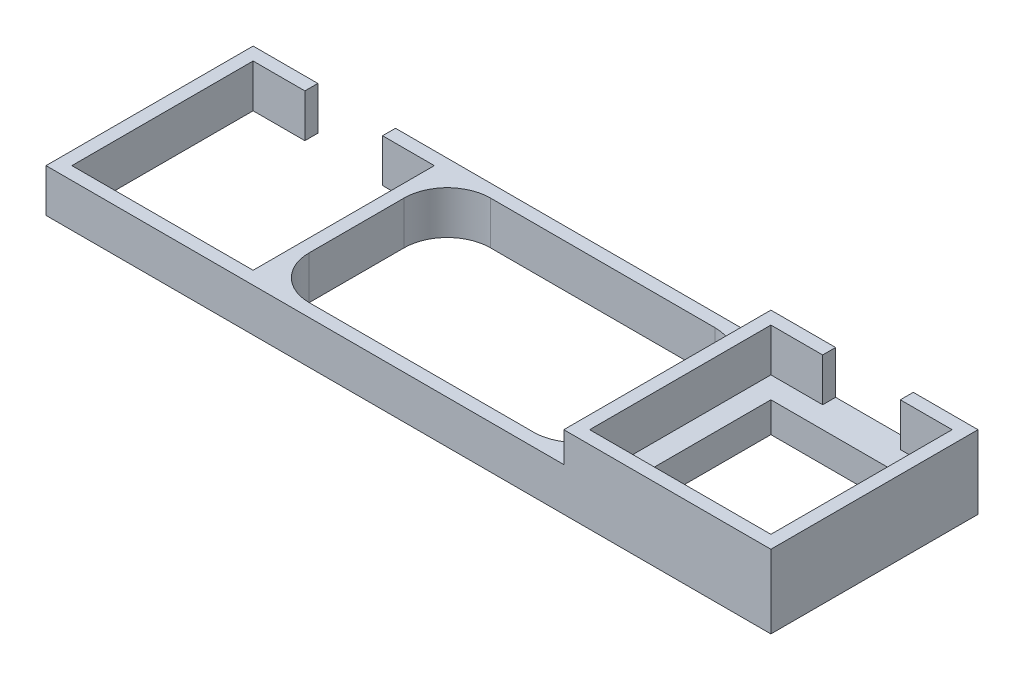
from build123d import *

# Parameters (mm, degrees)
SKETCH1_W           = 168
SKETCH1_H           = 48
SKETCH1_W_2         = 42
SKETCH1_H_2         = 42
SKETCH1_W_3         = 72
BOSS_EXTRUDE1_DEPTH = 10
SKETCH2_W           = 18
SKETCH2_H           = 10
CUT_EXTRUDE1_DEPTH  = 10
SKETCH3_W           = 42
SKETCH3_H           = 42
SKETCH3_W_2         = 32
SKETCH3_H_2         = 32
BOSS_EXTRUDE2_DEPTH = 7
BOSS_EXTRUDE3_DEPTH = 7
FILLET1_R           = 10
SKETCH6_W           = 18
SKETCH6_H           = 7
BOSS_EXTRUDE4_DEPTH = 3


with BuildPart() as part:
    # Sketch1 → Boss-Extrude1 (new body)
    with BuildSketch(Plane(origin=(0, 0, 0), x_dir=(1, 0, 0), z_dir=(0, 1, 0))):
        with Locations((-81, 21)):
            Rectangle(SKETCH1_W, SKETCH1_H)
        with Locations((-141, 21)):
            Rectangle(SKETCH1_W_2, SKETCH1_H_2, mode=Mode.SUBTRACT)
        with Locations((-21, 21)):
            Rectangle(SKETCH1_W_2, SKETCH1_H_2, mode=Mode.SUBTRACT)
        with Locations((-81, 21)):
            Rectangle(SKETCH1_W_3, SKETCH1_H_2, mode=Mode.SUBTRACT)
    extrude(amount=BOSS_EXTRUDE1_DEPTH)

    # Sketch2 → Cut-Extrude1 (cut)
    with BuildSketch(Plane(origin=(0, 0, -45), x_dir=(-1, 0, 0), z_dir=(0, 0, -1))):
        with Locations((21, 5)):
            Rectangle(SKETCH2_W, SKETCH2_H)
        with Locations((141, 5)):
            Rectangle(SKETCH2_W, SKETCH2_H)
    extrude(amount=-CUT_EXTRUDE1_DEPTH, mode=Mode.SUBTRACT)

    # Sketch3 → Boss-Extrude2 (add)
    with BuildSketch(Plane.XZ):
        with Locations((-21, -21)):
            Rectangle(SKETCH3_W, SKETCH3_H)
        with Locations((-21, -21)):
            Rectangle(SKETCH3_W_2, SKETCH3_H_2, mode=Mode.SUBTRACT)
    extrude(amount=-BOSS_EXTRUDE2_DEPTH)

    # Sketch4 → Boss-Extrude3 (add)
    with BuildSketch(Plane(origin=(0, 10, 0), x_dir=(1, 0, 0), z_dir=(0, 1, 0))):
        Polygon((-42, 42), (-30, 42), (-30, 45), (-42, 45), (-45, 45), (-45, 42), (-45, 0), (-45, -3), (-42, -3), (3, -3), (3, 0), (3, 42), (3, 45), (0, 45), (-12, 45), (-12, 42), (0, 42), (0, 0), (-42, 0), align=None)
    extrude(amount=BOSS_EXTRUDE3_DEPTH)

    # Fillet1
    fillet1_edges = [part.edges().sort_by_distance(p)[0] for p in [
        (-117, 5, -42),
        (-117, 5, 0),
        (-45, 5, 0),
        (-45, 5, -42),
    ]]
    fillet(fillet1_edges, radius=FILLET1_R)

    # Sketch6 → Boss-Extrude4 (add)
    with BuildSketch(Plane(origin=(0, 0, -42), x_dir=(-1, 0, 0), z_dir=(0, 0, -1))):
        with Locations((21, 3.5)):
            Rectangle(SKETCH6_W, SKETCH6_H)
    extrude(amount=BOSS_EXTRUDE4_DEPTH)


solid = part.part
